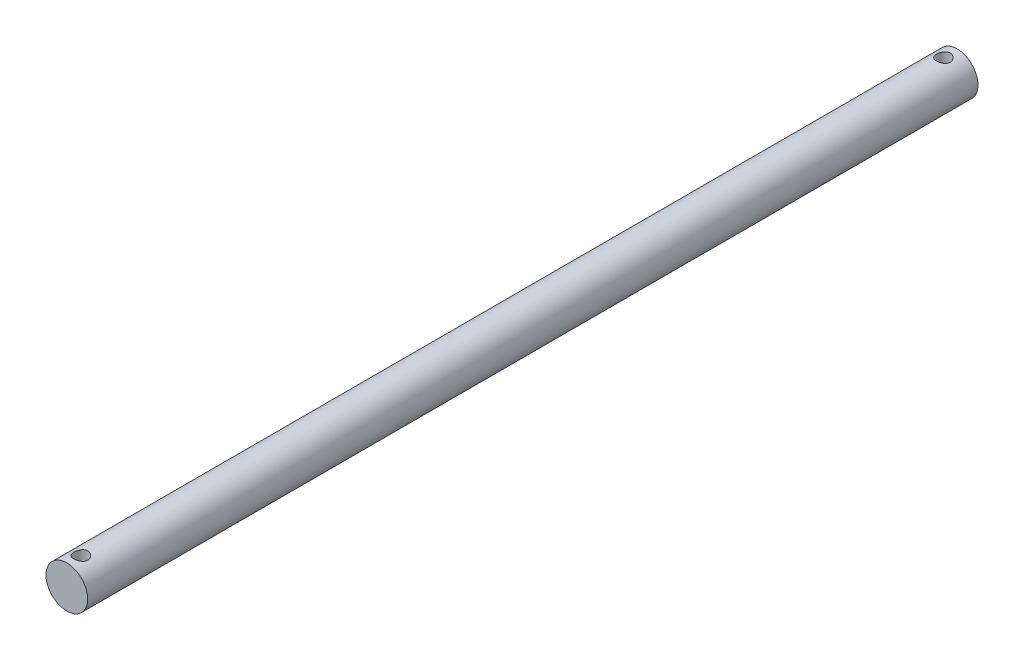
from build123d import *

# Parameters (mm, degrees)
SKETCH1_R             = 4.7625
BOSS_EXTRUDE1_DEPTH   = 101.6
SKETCH2_R             = 1.5875
SPLIT_RING_HOLE_DEPTH = 102.822997464


with BuildPart() as part:
    # Sketch1 → Boss-Extrude1 (new, symmetric)
    with BuildSketch(Plane.XY):
        Circle(SKETCH1_R)
    extrude(amount=BOSS_EXTRUDE1_DEPTH, both=True)

    # Sketch2 → Split Ring Hole (cut, symmetric)
    with BuildSketch(Plane(origin=(0, 0, 0), x_dir=(1, 0, 0), z_dir=(0, 1, 0))):
        with Locations(Location((0, 98.425, 0), (0, 0, 270))):
            Circle(SKETCH2_R)
    split_ring_hole = extrude(amount=SPLIT_RING_HOLE_DEPTH, both=True, mode=Mode.SUBTRACT)

    # Mirror1: Split Ring Hole across plane
    add(split_ring_hole.mirror(Plane.XY), mode=Mode.SUBTRACT)


solid = part.part
